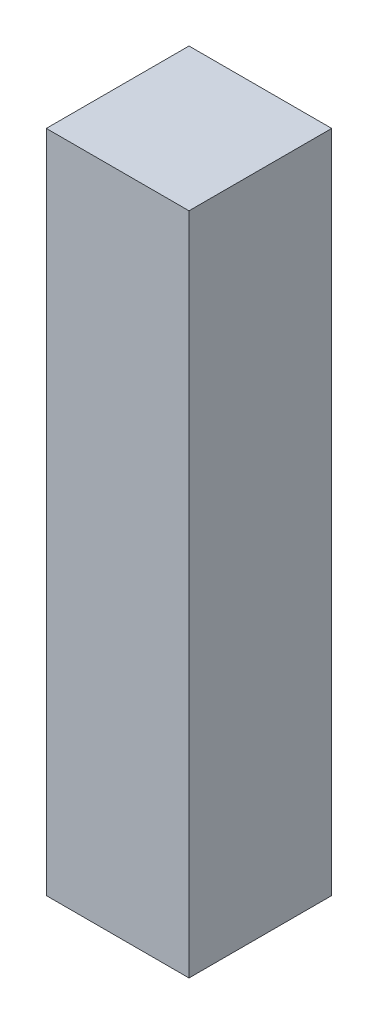
from build123d import *

# Parameters (mm, degrees)
SKETCH1_W           = 255
SKETCH1_H           = 255
BOSS_EXTRUDE1_DEPTH = 1187.25


with BuildPart() as part:
    # Sketch1 → Boss-Extrude1 (new body)
    with BuildSketch(Plane(origin=(0, 0, 0), x_dir=(1, 0, 0), z_dir=(0, 1, 0))):
        Rectangle(SKETCH1_W, SKETCH1_H)
    extrude(amount=BOSS_EXTRUDE1_DEPTH)


solid = part.part
